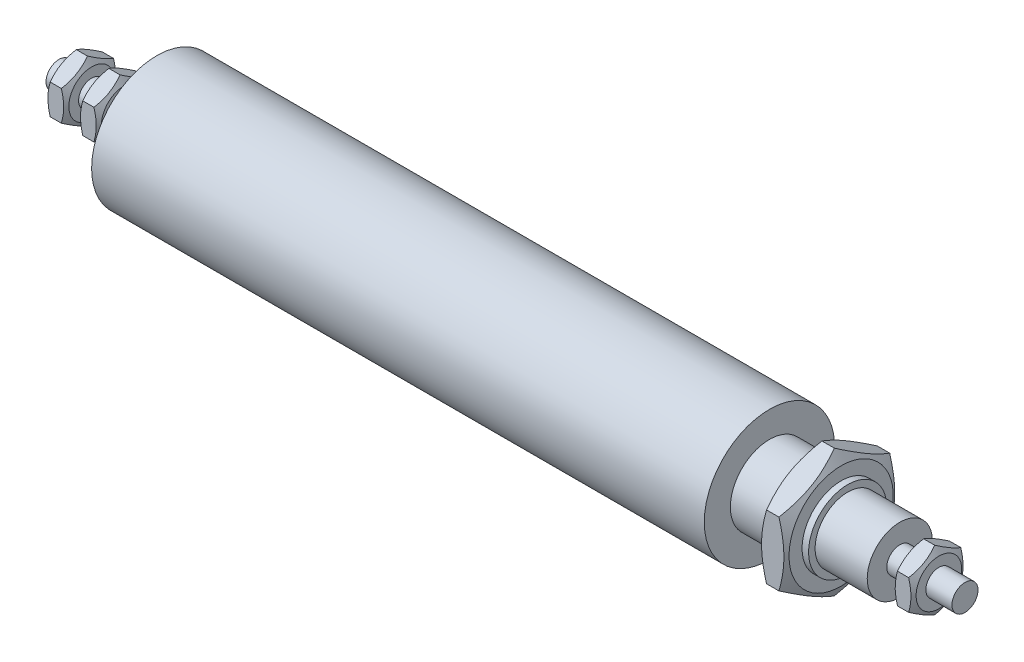
from build123d import *

# Parameters (mm, degrees)
SKETCH2_OUTSIDE_W  = 53.474
SKETCH2_OUTSIDE_H  = 53.474
CUT_EXTRUDE1_DEPTH = 3
SKETCH3_OUTSIDE_W  = 53.474
SKETCH3_OUTSIDE_H  = 53.474
CUT_EXTRUDE2_DEPTH = 4
SKETCH4_OUTSIDE_W  = 50.37
SKETCH4_OUTSIDE_H  = 50.37
CUT_EXTRUDE3_DEPTH = 8


with BuildPart() as part:
    # Sketch1 → Revolve1 (revolve)
    with BuildSketch(Plane.XY, mode=Mode.PRIVATE) as revolve1_sk:
        Polygon((30, 0), (-109, 0), (-109, 2), (-107, 2), (-107, 3.5), (-105.5, 6.098076211), (-104, 3.5), (-104, 2), (-102, 2), (-102, 3.5), (-100.5, 6.098076211), (-99, 3.5), (-99, 2), (-94, 2), (-94, 10), (0, 10), (0, 6), (7, 6), (7, 8), (9, 11.464101615), (11, 8), (11, 6), (12, 6), (12, 5), (20, 5), (20, 2), (23, 2), (23, 3.5), (24.5, 6.098076211), (26, 3.5), (26, 2), (30, 2), align=None)
    revolve(revolve1_sk.sketch.rotate(Axis((30, 0, 0), (1, 0, 0)), 90), axis=Axis((30, 0, 0), (1, 0, 0)))

    # Sketch2 outside → Cut-Extrude1 (cut)
    with BuildSketch(Plane(origin=(26, 0, 0), x_dir=(0, 0, -1), z_dir=(1, 0, 0))):
        Rectangle(SKETCH2_OUTSIDE_W, SKETCH2_OUTSIDE_H)
        Polygon((0, -4.618802154), (4, -2.309401077), (4, 2.309401077), (0, 4.618802154), (-4, 2.309401077), (-4, -2.309401077), align=None, mode=Mode.SUBTRACT)
    extrude(amount=-CUT_EXTRUDE1_DEPTH, mode=Mode.SUBTRACT)

    # Sketch3 outside → Cut-Extrude2 (cut)
    with BuildSketch(Plane(origin=(11, 0, 0), x_dir=(0, 0, -1), z_dir=(1, 0, 0))):
        Rectangle(SKETCH3_OUTSIDE_W, SKETCH3_OUTSIDE_H)
        Polygon((0, 9.814954576), (-8.5, 4.907477288), (-8.5, -4.907477288), (0, -9.814954576), (8.5, -4.907477288), (8.5, 4.907477288), align=None, mode=Mode.SUBTRACT)
    extrude(amount=-CUT_EXTRUDE2_DEPTH, mode=Mode.SUBTRACT)

    # Sketch4 outside → Cut-Extrude3 (cut)
    with BuildSketch(Plane.ZY.offset(107)):
        Rectangle(SKETCH4_OUTSIDE_W, SKETCH4_OUTSIDE_H)
        Polygon((0, 4.618802154), (-4, 2.309401077), (-4, -2.309401077), (0, -4.618802154), (4, -2.309401077), (4, 2.309401077), align=None, mode=Mode.SUBTRACT)
    extrude(amount=-CUT_EXTRUDE3_DEPTH, mode=Mode.SUBTRACT)


solid = part.part
